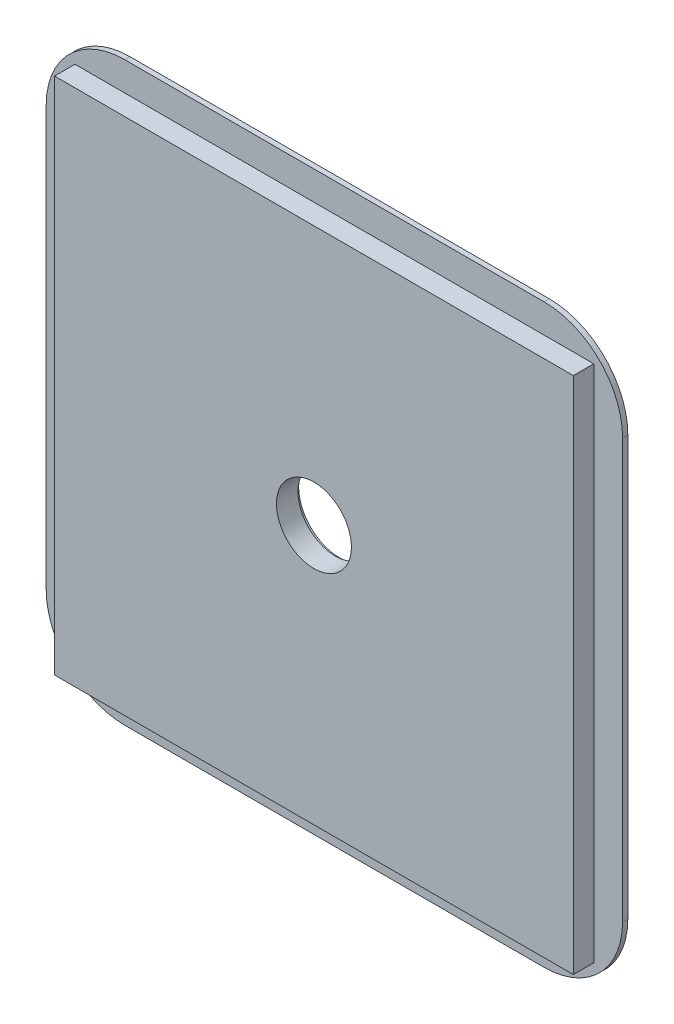
from build123d import *

# Parameters (mm, degrees)
SKETCH_1_W          = 99
SKETCH_1_H          = 99
EXTRUDE_1_DEPTH     = 3.9
SKETCH_2_W          = 110
SKETCH_2_H          = 110
EXTRUDE_2_DEPTH     = 1
SKETCH_3_R          = 7.15
CUT_EXTRUDE_1_DEPTH = 78.935935229
SKETCH_5_R          = 7.825
CUT_EXTRUDE_2_DEPTH = 0.8
FILLET_1_R          = 15


with BuildPart() as part:
    # 草图1 → 凸台-拉伸1 (new body)
    with BuildSketch(Plane.XY):
        Rectangle(SKETCH_1_W, SKETCH_1_H)
    extrude(amount=EXTRUDE_1_DEPTH)

    # 草图2 → 凸台-拉伸2 (add)
    with BuildSketch(Plane(origin=(0, 0, 0), x_dir=(-1, 0, 0), z_dir=(0, 0, -1))):
        Rectangle(SKETCH_2_W, SKETCH_2_H)
    extrude(amount=EXTRUDE_2_DEPTH)

    # 草图3 → 切除-拉伸1 (cut, through all)
    with BuildSketch(Plane(origin=(0, 0, -1), x_dir=(-1, 0, 0), z_dir=(0, 0, -1))):
        Circle(SKETCH_3_R)
    extrude(amount=-CUT_EXTRUDE_1_DEPTH, mode=Mode.SUBTRACT)

    # 草图5 → 切除-拉伸2 (cut)
    with BuildSketch(Plane(origin=(0, 0, -1), x_dir=(-1, 0, 0), z_dir=(0, 0, -1))):
        Circle(SKETCH_5_R)
    extrude(amount=-CUT_EXTRUDE_2_DEPTH, mode=Mode.SUBTRACT)

    # 圆角1
    fillet_1_edges = [part.edges().sort_by_distance(p)[0] for p in [
        (-55, -55, -0.5),
        (-55, 55, -0.5),
        (55, 55, -0.5),
        (55, -55, -0.5),
    ]]
    fillet(fillet_1_edges, radius=FILLET_1_R)


solid = part.part
